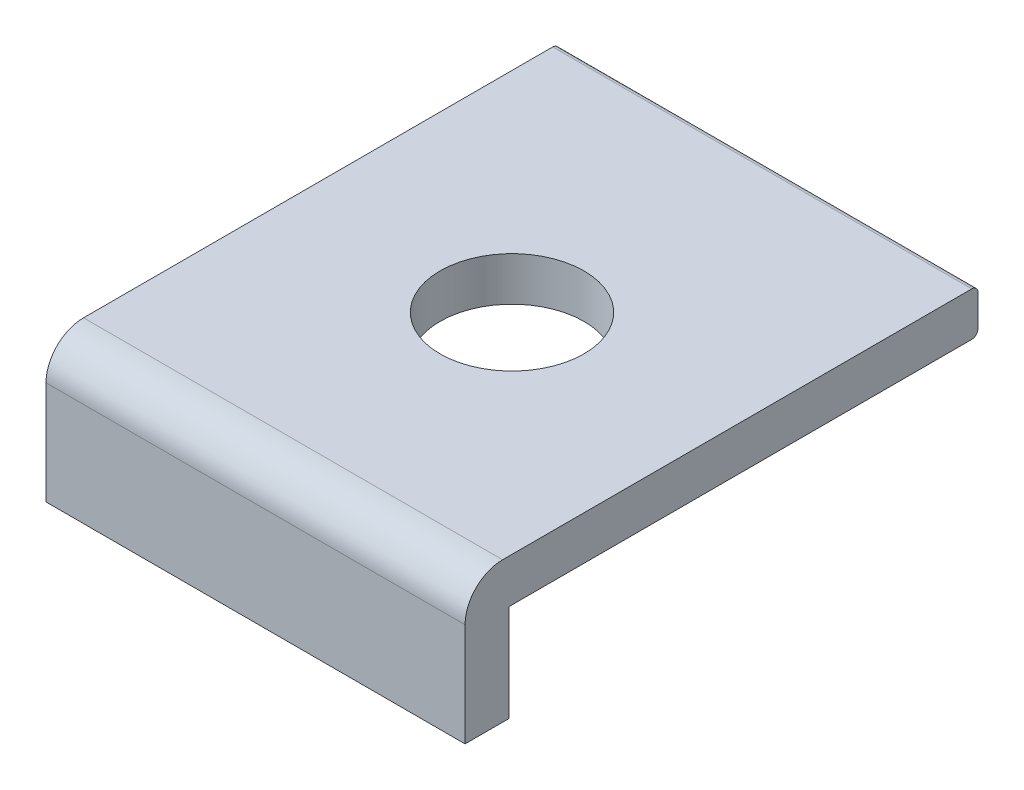
from build123d import *

# Parameters (mm, degrees)
RESSALTO_EXTRUS_O12_DEPTH = 6.7
ESBO_O7_R                 = 1.15
CORTE_EXTRUS_O3_DEPTH     = 6.7


with BuildPart() as part:
    # Esboço4 → Ressalto-extrusão12 (new body)
    with BuildSketch(Plane(origin=(0, 0, 0), x_dir=(0, 0, -1), z_dir=(1, 0, 0))):
        with BuildLine():
            Line((0, 0), (0, 1.65))
            ThreePointArc((0, 1.65), (0.175735931, 2.074264069), (0.6, 2.25))
            Line((0.6, 2.25), (8.101, 2.25))
            ThreePointArc((8.101, 2.25), (8.171710678, 2.220710678), (8.201, 2.15))
            Line((8.201, 2.15), (8.201, 1.65))
            ThreePointArc((8.201, 1.65), (8.171710678, 1.579289322), (8.101, 1.55))
            Line((8.101, 1.55), (0.7, 1.55))
            Line((0.7, 1.55), (0.7, 0))
            Line((0.7, 0), (0, 0))
        make_face()
    extrude(amount=RESSALTO_EXTRUS_O12_DEPTH)

    # Esboço7 → Corte-extrusão3 (cut)
    with BuildSketch(Plane(origin=(0, 2.25, 0), x_dir=(1, 0, 0), z_dir=(0, 1, 0))):
        with Locations(Location((3.35, 4.1005, 0), (0, 0, 270))):
            Circle(ESBO_O7_R)
    extrude(amount=-CORTE_EXTRUS_O3_DEPTH, mode=Mode.SUBTRACT)


solid = part.part
